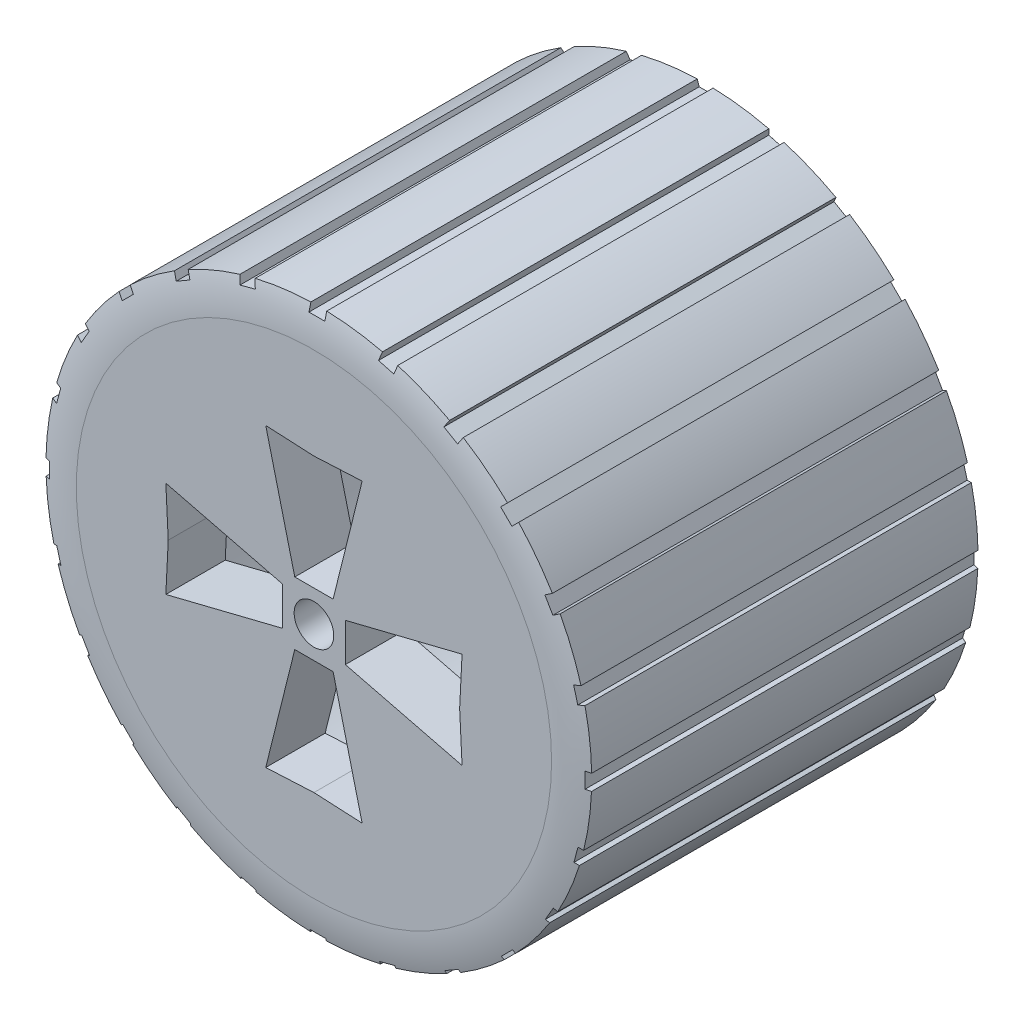
from build123d import *

# Parameters (mm, degrees)
CUT_EXTRUDE1_DEPTH      = 10.848857802
CUT_EXTRUDE1_DEPTH_BACK = 10.848857802
SKETCH3_R               = 0.5
CUT_EXTRUDE4_DEPTH      = 3.5
CUT_EXTRUDE4_DEPTH_BACK = 10.848857802
SKETCH4_R               = 5
CUT_EXTRUDE8_DEPTH      = 1.5
CUT_EXTRUDE9_DEPTH      = 11.950551982
CUT_EXTRUDE9_DEPTH_BACK = 11.950551982
SKETCH7_W               = 0.4
SKETCH7_H               = 0.4


with BuildPart() as part:
    # Sketch2 → Revolve1 (revolve)
    with BuildSketch(Plane(origin=(0, 0, 0), x_dir=(0, 0, -1), z_dir=(1, 0, 0))):
        Polygon((-5, 6), (-5, 0), (5, 0), (5, 6), (4.252749746, 6), (3.5, 5.247250254), (-3.5, 5.247250254), (-4.252749746, 6), align=None)
    revolve(axis=Axis((0, 0, 12.99734566), (0, 0, -1)))

    # Sketch3 → Cut-Extrude1 (cut, two sides: drawn at the far end of the back side and taken through both)
    with BuildSketch(Plane.XY.offset(-CUT_EXTRUDE1_DEPTH_BACK)):
        Circle(SKETCH3_R)
    extrude(amount=CUT_EXTRUDE1_DEPTH + CUT_EXTRUDE1_DEPTH_BACK, mode=Mode.SUBTRACT)

    # Sketch4 → Cut-Extrude4 (cut, two sides: drawn at the far end of the back side and taken through both)
    with BuildSketch(Plane.XY.offset(-CUT_EXTRUDE4_DEPTH_BACK)):
        Circle(SKETCH4_R)
    extrude(amount=CUT_EXTRUDE4_DEPTH + CUT_EXTRUDE4_DEPTH_BACK, mode=Mode.SUBTRACT)

    # Sketch6 → Cut-Extrude8 (cut)
    with BuildSketch(Plane.XY.offset(5)):
        Polygon((-0.483975087, 0.793387624), (-1.216950806, 3.739249566), (0, 3.678529741), (1.216950806, 3.739249566), (0.483975087, 0.793387624), align=None)
        Polygon((0.793387624, 0.483975087), (0.793387624, -0.483975087), (3.739249566, -1.216950806), (3.678529741, 0), (3.739249566, 1.216950806), align=None)
        Polygon((0.483975087, -0.793387624), (-0.483975087, -0.793387624), (-1.216950806, -3.739249566), (0, -3.678529741), (1.216950806, -3.739249566), align=None)
        Polygon((-0.793387624, -0.483975087), (-0.793387624, 0.483975087), (-3.739249566, 1.216950806), (-3.678529741, 0), (-3.739249566, -1.216950806), align=None)
    extrude(amount=-CUT_EXTRUDE8_DEPTH, mode=Mode.SUBTRACT)

    # Sketch2<3> → Revolve2 (revolve)
    with BuildSketch(Plane(origin=(0, 0, 0), x_dir=(0, 0, -1), z_dir=(1, 0, 0))):
        with BuildLine():
            ThreePointArc((-4.876657647, 6.888925486), (-4.969017406, 6.44872092), (-5, 6))
            Line((-5, 6), (-4.252749746, 6))
            Line((-4.252749746, 6), (-3.5, 5.247250254))
            Line((-3.5, 5.247250254), (3.5, 5.247250254))
            Line((3.5, 5.247250254), (4.252749746, 6))
            Line((4.252749746, 6), (5, 6))
            ThreePointArc((5, 6), (4.969017406, 6.44872092), (4.876657647, 6.888925486))
            Line((4.876657647, 6.888925486), (-4.876657647, 6.888925486))
        make_face()
    revolve(axis=Axis((0, 0, 12.99734566), (0, 0, -1)))

    # Sketch7 → Cut-Extrude9 (cut, two sides: drawn at the far end of the back side and taken through both)
    with BuildSketch(Plane.XY.offset(-CUT_EXTRUDE9_DEPTH_BACK)):
        with Locations((0, 6.888925486)):
            Rectangle(SKETCH7_W, SKETCH7_H)
        Polygon((1.659420639, 6.895318257), (2.045790969, 6.791790639), (1.942263351, 6.405420309), (1.555893021, 6.508947927), align=None)
        Polygon((3.405373818, 6.227054561), (3.751783979, 6.027054561), (3.551783979, 5.680644399), (3.205373818, 5.880644399), align=None)
        Polygon((4.918875713, 5.129675463), (5.201718426, 4.84683275), (4.918875713, 4.563990038), (4.636033001, 4.84683275), align=None)
        Polygon((6.096783672, 3.677965535), (6.296783672, 3.331555374), (5.95037351, 3.131555374), (5.75037351, 3.477965535), align=None)
        Polygon((6.858825212, 1.970856411), (6.96235283, 1.584486081), (6.5759825, 1.480958462), (6.472454882, 1.867328793), align=None)
        with Locations((6.953068464, -0.075315244)):
            Rectangle(SKETCH7_W, SKETCH7_H)
        Polygon((6.959461235, -1.734735883), (6.855933617, -2.121106214), (6.469563286, -2.017578596), (6.573090905, -1.631208265), align=None)
        Polygon((6.291197538, -3.480689062), (6.091197538, -3.827099224), (5.744787377, -3.627099224), (5.944787377, -3.280689062), align=None)
        Polygon((5.19381844, -4.994190957), (4.910975728, -5.27703367), (4.628133015, -4.994190957), (4.910975728, -4.711348245), align=None)
        Polygon((3.742108513, -6.172098916), (3.395698351, -6.372098916), (3.195698351, -6.025688754), (3.542108513, -5.825688754), align=None)
        Polygon((2.034999389, -6.934140457), (1.648629058, -7.037668075), (1.54510144, -6.651297744), (1.931471771, -6.547770126), align=None)
        with Locations((-0.011172267, -7.028383708)):
            Rectangle(SKETCH7_W, SKETCH7_H)
        Polygon((-1.670592906, -7.034776479), (-2.056963236, -6.931248861), (-1.953435618, -6.544878531), (-1.567065288, -6.648406149), align=None)
        Polygon((-3.416546085, -6.366512782), (-3.762956246, -6.166512782), (-3.562956246, -5.820102621), (-3.216546085, -6.020102621), align=None)
        Polygon((-4.93004798, -5.269133684), (-5.212890692, -4.986290972), (-4.93004798, -4.703448259), (-4.647205267, -4.986290972), align=None)
        Polygon((-6.107955938, -3.817423757), (-6.307955938, -3.471013595), (-5.961545777, -3.271013595), (-5.761545777, -3.617423757), align=None)
        Polygon((-6.869997479, -2.110314633), (-6.973525097, -1.723944302), (-6.587154767, -1.620416684), (-6.483627148, -2.006787015), align=None)
        with Locations((-6.964240731, -0.064142978)):
            Rectangle(SKETCH7_W, SKETCH7_H)
        Polygon((-6.970633502, 1.595277661), (-6.867105884, 1.981647992), (-6.480735553, 1.878120374), (-6.584263171, 1.491750043), align=None)
        Polygon((-6.302369805, 3.34123084), (-6.102369805, 3.687641002), (-5.755959643, 3.487641002), (-5.955959643, 3.14123084), align=None)
        Polygon((-5.204990707, 4.854732736), (-4.922147994, 5.137575448), (-4.639305282, 4.854732736), (-4.922147994, 4.571890023), align=None)
        Polygon((-3.753280779, 6.032640694), (-3.406870618, 6.232640694), (-3.206870618, 5.886230532), (-3.553280779, 5.686230532), align=None)
        Polygon((-2.046171655, 6.794682235), (-1.659801325, 6.898209853), (-1.556273707, 6.511839522), (-1.942644037, 6.408311904), align=None)
    extrude(amount=CUT_EXTRUDE9_DEPTH + CUT_EXTRUDE9_DEPTH_BACK, mode=Mode.SUBTRACT)


solid = part.part
